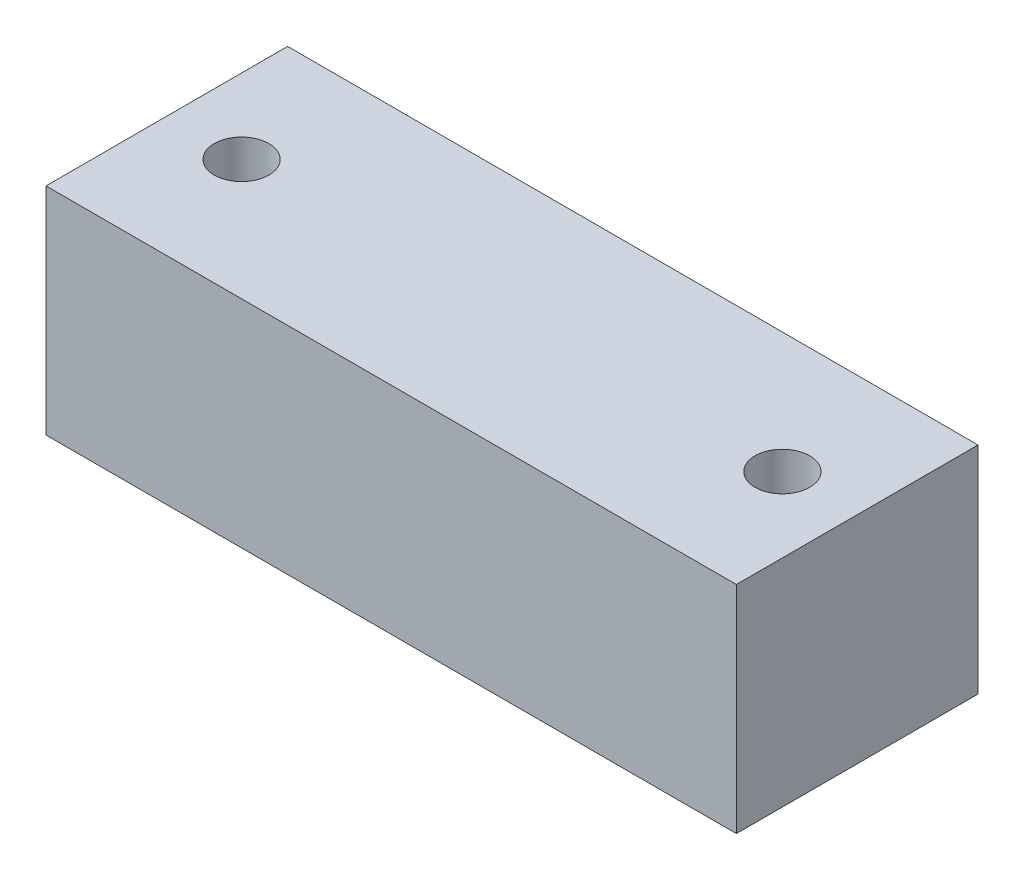
from build123d import *

# Parameters (mm, degrees)
CROQUIS1_W              = 48
CROQUIS1_H              = 16.8
CROQUIS1_R              = 1.9
SALIENTE_EXTRUIR1_DEPTH = 15


with BuildPart() as part:
    # Croquis1 → Saliente-Extruir1 (new body)
    with BuildSketch(Plane(origin=(0, 0, 0), x_dir=(1, 0, 0), z_dir=(0, 1, 0))):
        Rectangle(CROQUIS1_W, CROQUIS1_H)
        with Locations(Location((-18.8, 0, 0), (0, 0, 270))):
            Circle(CROQUIS1_R, mode=Mode.SUBTRACT)
        with Locations(Location((18.8, 0, 0), (0, 0, 270))):
            Circle(CROQUIS1_R, mode=Mode.SUBTRACT)
    extrude(amount=SALIENTE_EXTRUIR1_DEPTH)


solid = part.part
